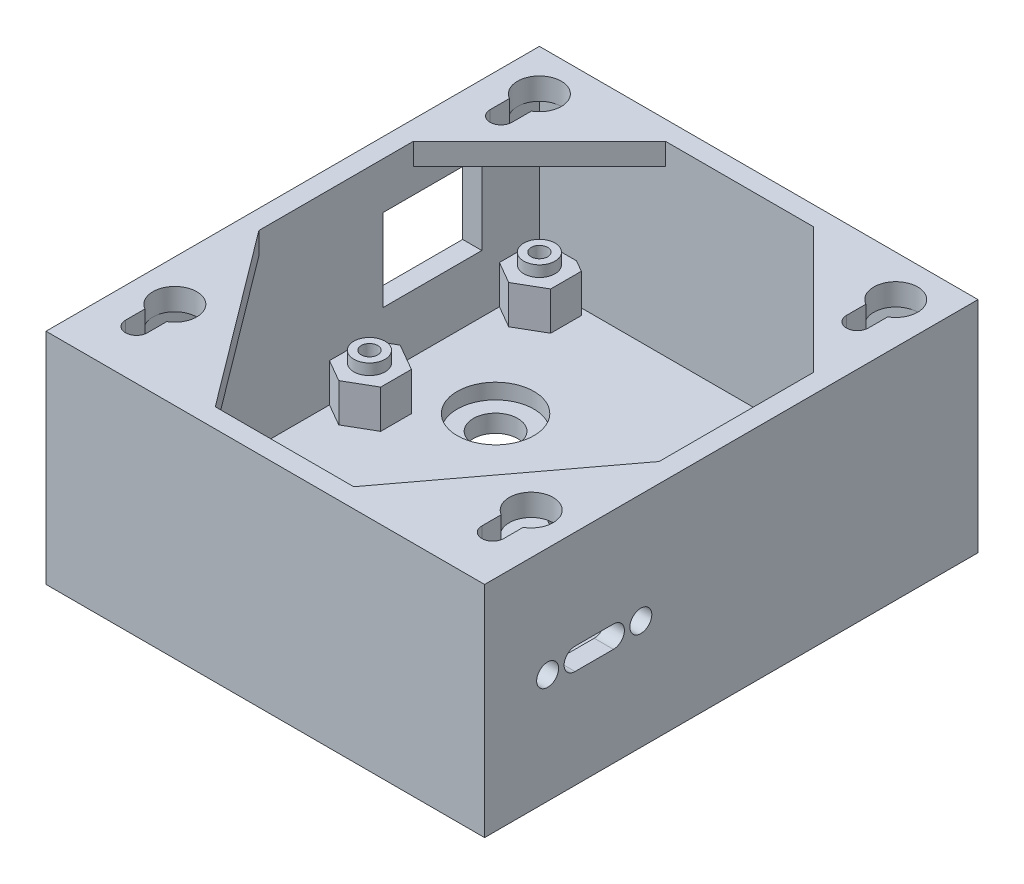
from build123d import *

# Parameters (mm, degrees)
SKETCH1_W               = 80
SKETCH1_H               = 90
BOSS_EXTRUDE1_DEPTH     = 6
SKETCH4_W               = 80
SKETCH4_H               = 90
SKETCH4_W_2             = 73
SKETCH4_H_2             = 83
BOSS_EXTRUDE2_DEPTH     = 34
SKETCH6_R               = 4.05
CUT_EXTRUDE1_DEPTH      = 40
SKETCH7_R               = 7
CUT_EXTRUDE2_DEPTH      = 2.8
BOSS_EXTRUDE3_DEPTH     = 7
SKETCH11_R              = 2.85
BOSS_EXTRUDE4_DEPTH     = 2
CUT_EXTRUDE3_DEPTH      = 9
CUT_EXTRUDE3_DEPTH_BACK = 6
SKETCH5_R               = 1.5
CUT_EXTRUDE4_DEPTH      = 6
CUT_EXTRUDE4_DEPTH_BACK = 70.144775652
SKETCH12_W              = 18
SKETCH12_H              = 15
CUT_EXTRUDE6_DEPTH      = 3.5
SKETCH17_R              = 8
CUT_EXTRUDE8_DEPTH      = 2
CUT_EXTRUDE9_DEPTH      = 1.5
CUT_EXTRUDE14_DEPTH     = 10
SKETCH30_R              = 2
CUT_EXTRUDE15_DEPTH     = 10
BOSS_EXTRUDE6_DEPTH     = 4
CUT_EXTRUDE12_DEPTH     = 4
SKETCH26_R              = 4
CUT_EXTRUDE13_DEPTH     = 4


with BuildPart() as part:
    # Sketch1 → Boss-Extrude1 (new body)
    with BuildSketch(Plane(origin=(0, 0, 0), x_dir=(1, 0, 0), z_dir=(0, 1, 0))):
        Rectangle(SKETCH1_W, SKETCH1_H)
    extrude(amount=BOSS_EXTRUDE1_DEPTH)

    # Sketch4 → Boss-Extrude2 (add)
    with BuildSketch(Plane(origin=(0, 6, 0), x_dir=(1, 0, 0), z_dir=(0, 1, 0))):
        Rectangle(SKETCH4_W, SKETCH4_H)
        Rectangle(SKETCH4_W_2, SKETCH4_H_2, mode=Mode.SUBTRACT)
    extrude(amount=BOSS_EXTRUDE2_DEPTH)

    # Sketch6 → Cut-Extrude1 (cut)
    with BuildSketch(Plane(origin=(0, 6, 0), x_dir=(1, 0, 0), z_dir=(0, 1, 0))):
        with Locations(Location((-20, 17, 0), (0, 0, 270))):
            Circle(SKETCH6_R)
        with Locations(Location((-20, -25, 0), (0, 0, 270))):
            Circle(SKETCH6_R)
    extrude(amount=-CUT_EXTRUDE1_DEPTH, mode=Mode.SUBTRACT)

    # Sketch7 → Cut-Extrude2 (cut)
    with BuildSketch(Plane(origin=(0, 6, 0), x_dir=(1, 0, 0), z_dir=(0, 1, 0))):
        with Locations(Location((-20, 17, 0), (0, 0, 270))):
            Circle(SKETCH7_R)
        with Locations(Location((-20, -25, 0), (0, 0, 270))):
            Circle(SKETCH7_R)
    extrude(amount=-CUT_EXTRUDE2_DEPTH, mode=Mode.SUBTRACT)

    # Sketch10 → Boss-Extrude3 (add)
    with BuildSketch(Plane(origin=(0, 6, 0), x_dir=(1, 0, 0), z_dir=(0, 1, 0))):
        Polygon((-32.5, 43.100297611), (-37.35, 40.300148806), (-37.35, 34.699851194), (-32.5, 31.899702389), (-27.65, 34.699851194), (-27.65, 40.300148806), align=None)
        Polygon((-27.65, 9.300148806), (-32.5, 12.100297611), (-37.35, 9.300148806), (-37.35, 3.699851194), (-32.5, 0.899702389), (-27.65, 3.699851194), align=None)
    extrude(amount=BOSS_EXTRUDE3_DEPTH)

    # Sketch11 → Boss-Extrude4 (add)
    with BuildSketch(Plane(origin=(0, 13, 0), x_dir=(1, 0, 0), z_dir=(0, 1, 0))):
        with Locations(Location((-32.5, 37.5, 0), (0, 0, 270))):
            Circle(SKETCH11_R)
        with Locations(Location((-32.5, 6.5, 0), (0, 0, 270))):
            Circle(SKETCH11_R)
    extrude(amount=BOSS_EXTRUDE4_DEPTH)

    # Sketch5 → Cut-Extrude3 (cut, two sides: drawn at the far end of the back side and taken through both)
    with BuildSketch(Plane(origin=(0, 6, 0), x_dir=(1, 0, 0), z_dir=(0, 1, 0)).offset(-CUT_EXTRUDE3_DEPTH_BACK)):
        with Locations(Location((-32.5, 37.5, 0), (0, 0, 270))):
            Circle(SKETCH5_R)
        with Locations(Location((-32.5, 6.5, 0), (0, 0, 270))):
            Circle(SKETCH5_R)
    extrude(amount=CUT_EXTRUDE3_DEPTH + CUT_EXTRUDE3_DEPTH_BACK, mode=Mode.SUBTRACT)

    # Sketch8 → Cut-Extrude4 (cut, two sides: drawn at the far end of the back side and taken through both)
    with BuildSketch(Plane(origin=(0, 6, 0), x_dir=(1, 0, 0), z_dir=(0, 1, 0)).offset(-CUT_EXTRUDE4_DEPTH_BACK)):
        Polygon((-29.65, 39.145448267), (-32.5, 40.790896534), (-35.35, 39.145448267), (-35.35, 35.854551733), (-32.5, 34.209103466), (-29.65, 35.854551733), align=None)
        Polygon((-29.65, 8.145448267), (-32.5, 9.790896534), (-35.35, 8.145448267), (-35.35, 4.854551733), (-32.5, 3.209103466), (-29.65, 4.854551733), align=None)
    extrude(amount=CUT_EXTRUDE4_DEPTH + CUT_EXTRUDE4_DEPTH_BACK, mode=Mode.SUBTRACT)

    # Sketch12 → Cut-Extrude6 (cut)
    with BuildSketch(Plane(origin=(-36.5, 0, 0), x_dir=(0, 0, -1), z_dir=(1, 0, 0))):
        with Locations((22, 24)):
            Rectangle(SKETCH12_W, SKETCH12_H)
    extrude(amount=-CUT_EXTRUDE6_DEPTH, mode=Mode.SUBTRACT)

    # Sketch17 → Cut-Extrude8 (cut)
    with BuildSketch(Plane.ZY.offset(40)):
        with Locations((29.75, 20)):
            Circle(SKETCH17_R)
    extrude(amount=-CUT_EXTRUDE8_DEPTH, mode=Mode.SUBTRACT)

    # Sketch15 → Cut-Extrude9 (cut)
    with BuildSketch(Plane(origin=(-36.5, 0, 0), x_dir=(0, 0, -1), z_dir=(1, 0, 0))):
        Polygon((-29.75, 32.990381057), (-41, 26.495190528), (-41, 13.504809472), (-29.75, 7.009618943), (-18.5, 13.504809472), (-18.5, 26.495190528), align=None)
    extrude(amount=-CUT_EXTRUDE9_DEPTH, mode=Mode.SUBTRACT)

    # Sketch29 → Cut-Extrude14 (cut)
    with BuildSketch(Plane(origin=(0, 6, 0), x_dir=(1, 0, 0), z_dir=(0, 1, 0))):
        with BuildLine():
            Line((8, 18.9), (8, 8.1))
            ThreePointArc((8, 8.1), (4, 4.1), (0, 8.1))
            Line((0, 8.1), (0, 18.9))
            ThreePointArc((0, 18.9), (4, 22.9), (8, 18.9))
        make_face()
    extrude(amount=-CUT_EXTRUDE14_DEPTH, mode=Mode.SUBTRACT)

    # Sketch30 → Cut-Extrude15 (cut)
    with BuildSketch(Plane(origin=(40, 0, 0), x_dir=(0, 0, -1), z_dir=(1, 0, 0))):
        with Locations((-33.5, 20)):
            Circle(SKETCH30_R)
        with Locations((-16.5, 20)):
            Circle(SKETCH30_R)
        with BuildLine():
            Line((-28.5, 22), (-21.5, 22))
            ThreePointArc((-21.5, 22), (-19.5, 20), (-21.5, 18))
            Line((-21.5, 18), (-28.5, 18))
            ThreePointArc((-28.5, 18), (-30.5, 20), (-28.5, 22))
        make_face()
    extrude(amount=-CUT_EXTRUDE15_DEPTH, mode=Mode.SUBTRACT)

    # Sketch23 → Boss-Extrude6 (add)
    with BuildSketch(Plane(origin=(0, 40, 0), x_dir=(1, 0, 0), z_dir=(0, 1, 0))):
        Polygon((-10, -45), (-40, -5), (-40, -45), align=None)
        Polygon((40, -45), (10, -45), (40, -5), align=None)
        Polygon((-40, 45), (-40, 15), (-10, 45), align=None)
        Polygon((10, 45), (40, 45), (40, 15), align=None)
    extrude(amount=-BOSS_EXTRUDE6_DEPTH)

    # Sketch27 → Cut-Extrude12 (cut)
    with BuildSketch(Plane(origin=(0, 40, 0), x_dir=(1, 0, 0), z_dir=(0, 1, 0))):
        with BuildLine():
            Line((-30.5, 37.5), (-30.5, 30.5))
            ThreePointArc((-30.5, 30.5), (-32.5, 28.5), (-34.5, 30.5))
            Line((-34.5, 30.5), (-34.5, 37.5))
            ThreePointArc((-34.5, 37.5), (-32.5, 39.5), (-30.5, 37.5))
        make_face()
        with BuildLine():
            Line((34.5, 37.5), (34.5, 30.5))
            ThreePointArc((34.5, 30.5), (32.5, 28.5), (30.5, 30.5))
            Line((30.5, 30.5), (30.5, 37.5))
            ThreePointArc((30.5, 37.5), (32.5, 39.5), (34.5, 37.5))
        make_face()
        with BuildLine():
            Line((34.5, -29), (34.5, -36))
            ThreePointArc((34.5, -36), (32.5, -38), (30.5, -36))
            Line((30.5, -36), (30.5, -29))
            ThreePointArc((30.5, -29), (32.5, -27), (34.5, -29))
        make_face()
        with BuildLine():
            Line((-30.5, -29), (-30.5, -36))
            ThreePointArc((-30.5, -36), (-32.5, -38), (-34.5, -36))
            Line((-34.5, -36), (-34.5, -29))
            ThreePointArc((-34.5, -29), (-32.5, -27), (-30.5, -29))
        make_face()
    extrude(amount=-CUT_EXTRUDE12_DEPTH, mode=Mode.SUBTRACT)

    # Sketch26 → Cut-Extrude13 (cut)
    with BuildSketch(Plane(origin=(0, 40, 0), x_dir=(1, 0, 0), z_dir=(0, 1, 0))):
        with Locations((-32.5, 37.5)):
            Circle(SKETCH26_R)
        with Locations((32.5, 37.5)):
            Circle(SKETCH26_R)
        with Locations((32.5, -29)):
            Circle(SKETCH26_R)
        with Locations((-32.5, -29)):
            Circle(SKETCH26_R)
    extrude(amount=-CUT_EXTRUDE13_DEPTH, mode=Mode.SUBTRACT)


solid = part.part
